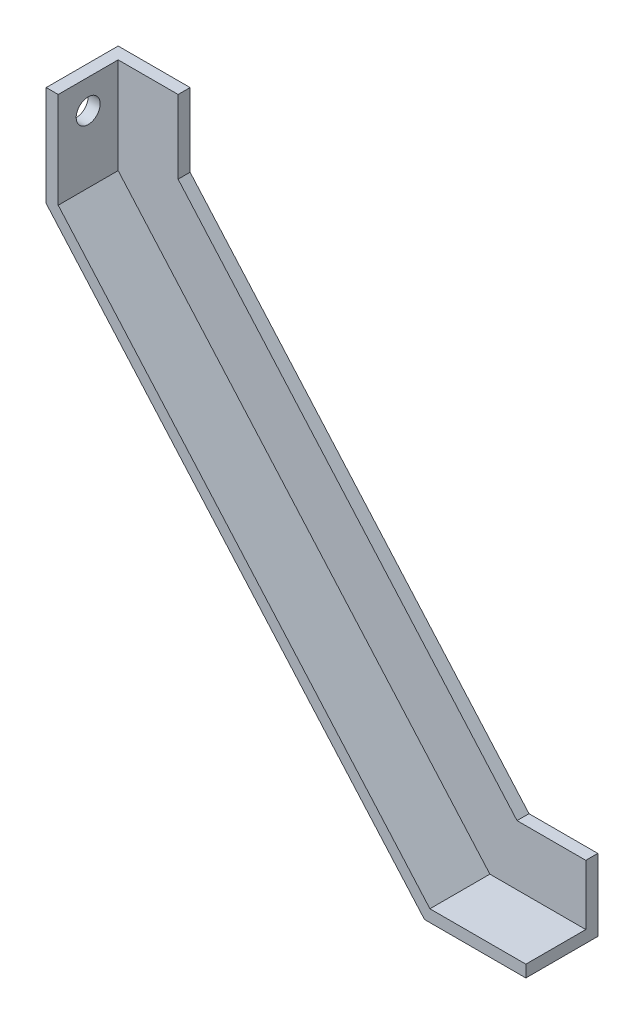
from build123d import *

# Parameters (mm, degrees)
BOSS_EXTRUDE1_DEPTH = 19.05
BOSS_EXTRUDE2_DEPTH = 3.175
SKETCH3_R           = 3.175
CUT_EXTRUDE1_DEPTH  = 189.387669682


with BuildPart() as part:
    # Sketch1 → Boss-Extrude1 (new body)
    with BuildSketch(Plane.XY):
        Polygon((0, 0), (0, -26.595904174), (100.162396017, -140.692505), (127, -140.692505), (127, -137.517505), (101.6, -137.517505), (3.175, -25.4), (3.175, 0), align=None)
    extrude(amount=BOSS_EXTRUDE1_DEPTH)

    # Sketch2 → Boss-Extrude2 (add)
    with BuildSketch(Plane(origin=(0, 0, 0), x_dir=(-1, 0, 0), z_dir=(0, 0, -1))):
        Polygon((-19.05, 0), (-3.175, 0), (-3.175, -25.4), (-101.6, -137.517505), (-127, -137.517505), (-127, -121.642505), (-108.788019913, -121.642505), (-19.05, -19.42047913), align=None)
    extrude(amount=-BOSS_EXTRUDE2_DEPTH)

    # Sketch3 → Cut-Extrude1 (cut, through all)
    with BuildSketch(Plane(origin=(3.175, 0, 0), x_dir=(0, 0, -1), z_dir=(1, 0, 0))):
        with Locations(Location((-11.1125, -7.690689216, 0), (0, 0, 90))):
            Circle(SKETCH3_R)
    extrude(amount=-CUT_EXTRUDE1_DEPTH, mode=Mode.SUBTRACT)


solid = part.part
